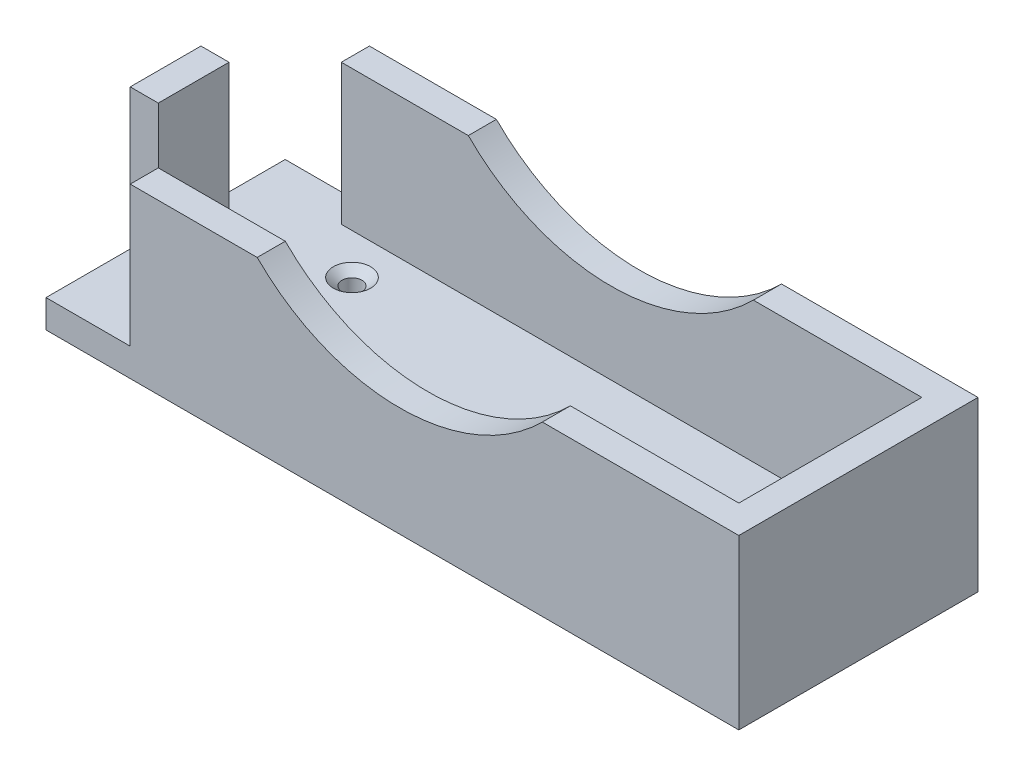
from build123d import *

# Parameters (mm, degrees)
SKETCH1_W                                         = 6.35
SKETCH1_H                                         = 16.002
BOSS_EXTRUDE1_DEPTH                               = 38.1
SKETCH1_H_2                                       = 54.102
BOSS_EXTRUDE1_2_DEPTH                             = 38.1
BOSS_EXTRUDE2_DEPTH                               = 6.35
SKETCH1_5_W                                       = 131.318
SKETCH1_5_H                                       = 6.35
BOSS_EXTRUDE3_DEPTH                               = 38.1
CSK_FOR_8_FLAT_HEAD_MACHINE_SCREW_100_D           = 4.4958
CSK_FOR_8_FLAT_HEAD_MACHINE_SCREW_100_CSINK_D     = 8.4328
CSK_FOR_8_FLAT_HEAD_MACHINE_SCREW_100_CSINK_ANGLE = 100
BOSS_EXTRUDE6_DEPTH                               = 6.35
CUT_EXTRUDE3_DEPTH                                = 105.525006773
CUT_EXTRUDE3_DEPTH_BACK                           = 105.525006773
BOSS_EXTRUDE7_DEPTH                               = 6.35


with BuildPart() as part:
    # Sketch1 → Boss-Extrude1 (new body)
    with BuildSketch(Plane(origin=(0, 0, 0), x_dir=(1, 0, 0), z_dir=(0, 1, 0))):
        with Locations((-72.630450684, -10.571178218)):
            Rectangle(SKETCH1_W, SKETCH1_H)
    extrude(amount=BOSS_EXTRUDE1_DEPTH)



with BuildPart() as body_2:
    # Sketch1 → Boss-Extrude1 2 (new body)
    with BuildSketch(Plane(origin=(0, 0, 0), x_dir=(1, 0, 0), z_dir=(0, 1, 0))):
        with Locations((77.737549316, -10.571178218)):
            Rectangle(SKETCH1_W, SKETCH1_H_2)
    extrude(amount=BOSS_EXTRUDE1_2_DEPTH)


with BuildPart() as part_1:
    add(part.part)

    add(body_2.part)  # Boss-Extrude2 merges body 2
    # Sketch1<4> → Boss-Extrude2 (add)
    with BuildSketch(Plane(origin=(0, 0, 0), x_dir=(1, 0, 0), z_dir=(0, 1, 0))):
        Polygon((-56.755450684, 10.129821782), (-69.455450684, 10.129821782), (-69.455450684, -2.570178218), (-69.455450684, -18.572178218), (-69.455450684, -31.272178218), (-56.755450684, -31.272178218), (74.562549316, -31.272178218), (74.562549316, 10.129821782), align=None)
    extrude(amount=BOSS_EXTRUDE2_DEPTH)

    # Sketch1<5> → Boss-Extrude3 (add)
    with BuildSketch(Plane(origin=(0, 0, 0), x_dir=(1, 0, 0), z_dir=(0, 1, 0))):
        with Locations((8.903549316, 13.304821782)):
            Rectangle(SKETCH1_5_W, SKETCH1_5_H)
        with Locations((8.903549316, -34.447178218)):
            Rectangle(SKETCH1_5_W, SKETCH1_5_H)
    extrude(amount=BOSS_EXTRUDE3_DEPTH)

    # CSK for #8 Flat Head Machine Screw (100)2 (through all)
    with Locations(Plane(origin=(0, 6.35, 0), x_dir=(1, 0, 0), z_dir=(0, 1, 0))):
        with Locations((-45.134950684, -21.937678218), (-45.134950684, 0.922321782), (50.115049316, 0.858821782), (50.115049316, -22.001178218)):
            CounterSinkHole(CSK_FOR_8_FLAT_HEAD_MACHINE_SCREW_100_D / 2, CSK_FOR_8_FLAT_HEAD_MACHINE_SCREW_100_CSINK_D / 2, counter_sink_angle=CSK_FOR_8_FLAT_HEAD_MACHINE_SCREW_100_CSINK_ANGLE)

    # Sketch1<8> → Boss-Extrude6 (add)
    with BuildSketch(Plane(origin=(0, 0, 0), x_dir=(1, 0, 0), z_dir=(0, 1, 0))):
        Polygon((-69.455450684, -31.272178218), (-69.455450684, -18.572178218), (-75.805450684, -18.572178218), (-75.805450684, -31.272178218), (-75.805450684, -37.622178218), (-56.755450684, -37.622178218), (-56.755450684, -31.272178218), align=None)
    extrude(amount=BOSS_EXTRUDE6_DEPTH)

    # Sketch11 → Cut-Extrude3 (cut, two sides: drawn at the far end of the back side and taken through both)
    with BuildSketch(Plane.XY.offset(37.622178218).offset(-CUT_EXTRUDE3_DEPTH_BACK)):
        with BuildLine():
            Line((-28.029969106, 38.1), (36.462549316, 38.1))
            ThreePointArc((36.462549316, 38.1), (4.216290105, 24.743162099), (-28.029969106, 38.1))
        make_face()
    extrude(amount=CUT_EXTRUDE3_DEPTH + CUT_EXTRUDE3_DEPTH_BACK, mode=Mode.SUBTRACT)

    # Sketch1<9> → Boss-Extrude7 (add)
    with BuildSketch(Plane(origin=(0, 0, 0), x_dir=(1, 0, 0), z_dir=(0, 1, 0))):
        Polygon((-69.455450684, -2.570178218), (-69.455450684, 10.129821782), (-56.755450684, 10.129821782), (-56.755450684, 16.479821782), (-69.455450684, 16.479821782), (-75.805450684, 16.479821782), (-75.805450684, 10.129821782), (-75.805450684, -2.570178218), align=None)
    extrude(amount=BOSS_EXTRUDE7_DEPTH)


solid = part_1.part
